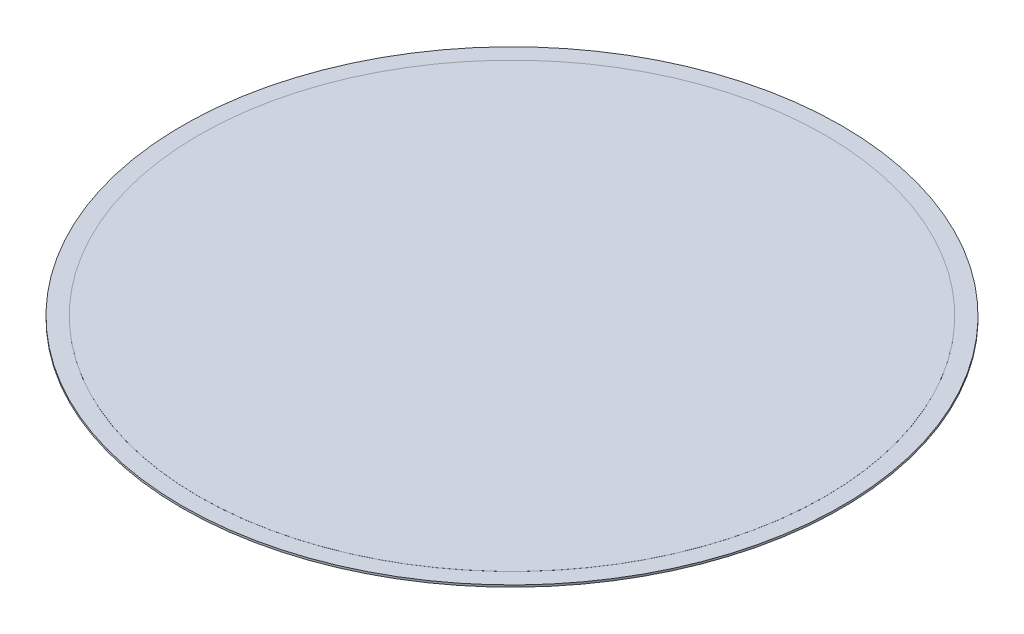
from build123d import *

# Parameters (mm, degrees)
SKETCH1_R           = 500
BOSS_EXTRUDE2_DEPTH = 3
SKETCH3_R           = 475
BOSS_EXTRUDE4_DEPTH = 0.1


with BuildPart() as part:
    # Sketch1 → Boss-Extrude2 (new body)
    with BuildSketch(Plane(origin=(0, 0, 0), x_dir=(1, 0, 0), z_dir=(0, 1, 0))):
        with Locations(Location((0, 0, 0), (0, 0, 270))):
            Circle(SKETCH1_R)
    extrude(amount=BOSS_EXTRUDE2_DEPTH)

    # Sketch3 → Boss-Extrude4 (add)
    with BuildSketch(Plane(origin=(0, 3, 0), x_dir=(1, 0, 0), z_dir=(0, 1, 0))):
        with Locations(Location((0, 0, 0), (0, 0, 270))):
            Circle(SKETCH3_R)
    extrude(amount=BOSS_EXTRUDE4_DEPTH)


solid = part.part
